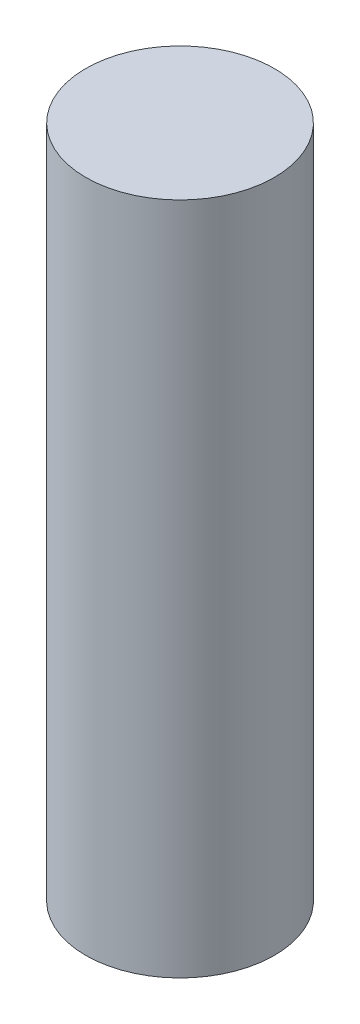
from build123d import *

# Parameters (mm, degrees)
SKETCH1_R           = 3.5
BOSS_EXTRUDE1_DEPTH = 25


with BuildPart() as part:
    # Sketch1 → Boss-Extrude1 (new body)
    with BuildSketch(Plane(origin=(0, 0, 0), x_dir=(1, 0, 0), z_dir=(0, 1, 0))):
        with Locations(Location((0, 0, 0), (0, 0, 270))):
            Circle(SKETCH1_R)
    extrude(amount=BOSS_EXTRUDE1_DEPTH)


solid = part.part
